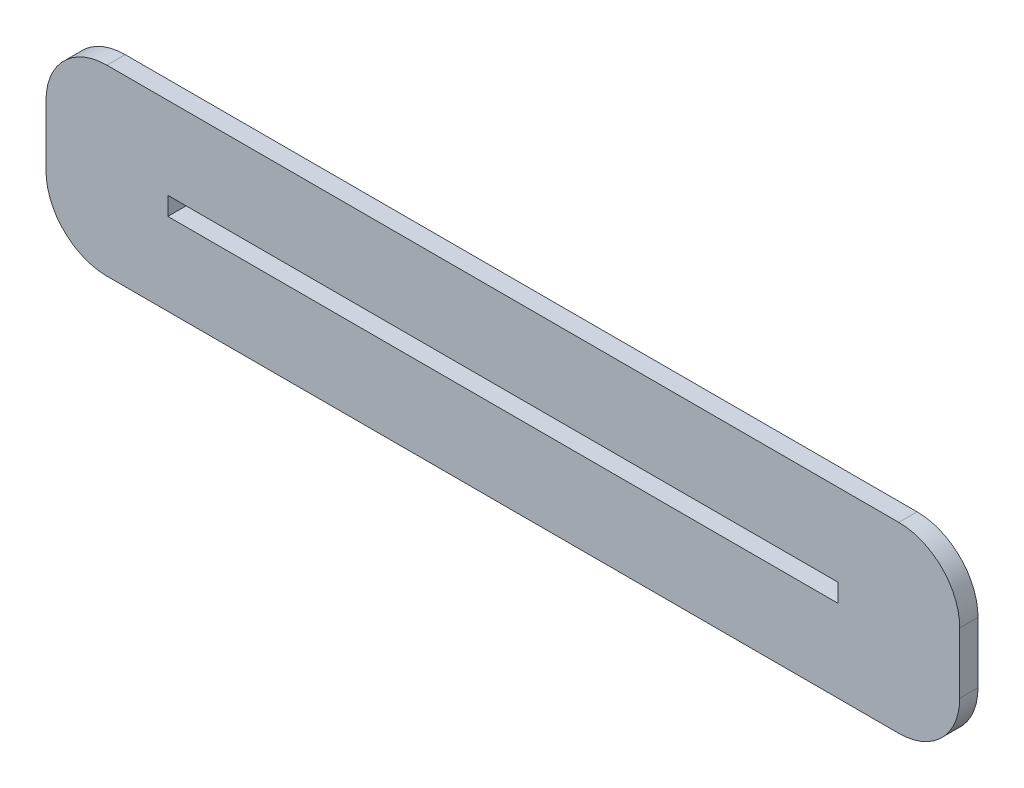
from build123d import *

# Parameters (mm, degrees)
SKETCH1_W           = 150
SKETCH1_H           = 30
SKETCH1_W_2         = 110
SKETCH1_H_2         = 3
BOSS_EXTRUDE1_DEPTH = 3
FILLET1_R           = 10


with BuildPart() as part:
    # Sketch1 → Boss-Extrude1 (new body)
    with BuildSketch(Plane.XY):
        with Locations((75, 15)):
            Rectangle(SKETCH1_W, SKETCH1_H)
        with Locations((75, 15)):
            Rectangle(SKETCH1_W_2, SKETCH1_H_2, mode=Mode.SUBTRACT)
    extrude(amount=BOSS_EXTRUDE1_DEPTH)

    # Fillet1
    fillet1_edges = [part.edges().sort_by_distance(p)[0] for p in [
        (0, 30, 1.5),
        (150, 30, 1.5),
        (150, 0, 1.5),
        (0, 0, 1.5),
    ]]
    fillet(fillet1_edges, radius=FILLET1_R)


solid = part.part
